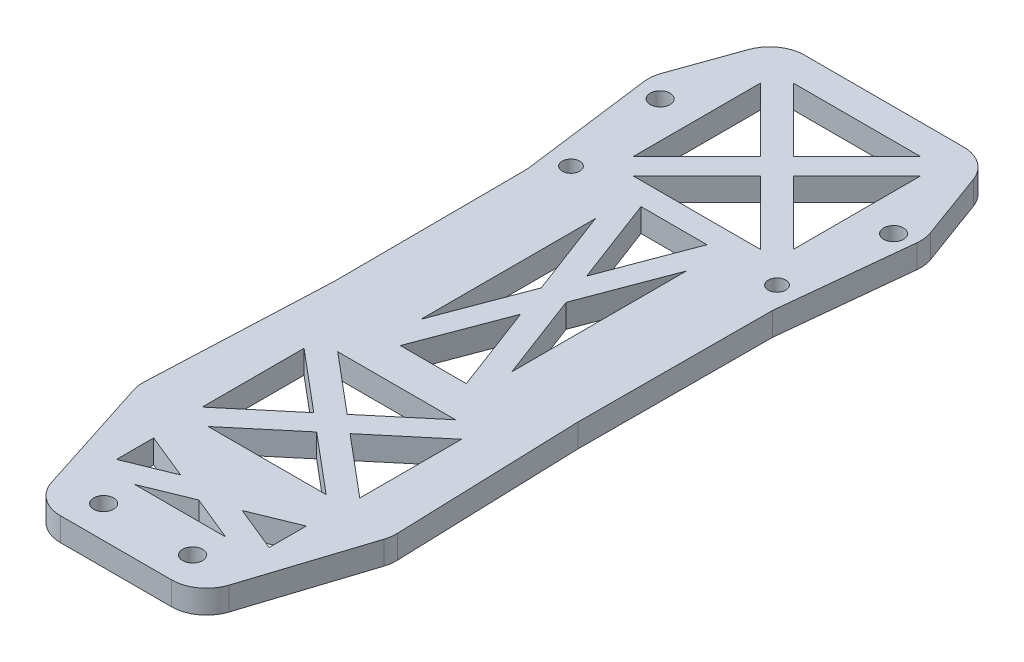
from build123d import *

# Parameters (mm, degrees)
BOSS_EXTRUDE1_DEPTH  = 4
M3_CLEARANCE_HOLE1_D = 3.4
SKETCH4_R            = 1.5
CUT_EXTRUDE1_DEPTH   = 135.330995523


with BuildPart() as part:
    # Sketch1 → Boss-Extrude1 (new body)
    with BuildSketch(Plane(origin=(0, 0, 0), x_dir=(1, 0, 0), z_dir=(0, 1, 0))):
        with BuildLine():
            Line((-9.515488572, 0), (9.515488572, 0))
            ThreePointArc((9.515488572, 0), (13.049333225, 1.15108858), (15.227255138, 4.162686012))
            Line((15.227255138, 4.162686012), (21.674585029, 24.205881435))
            ThreePointArc((21.674585029, 24.205881435), (21.904821248, 25.210967753), (21.959569126, 26.240632696))
            Line((21.959569126, 26.240632696), (20.905492982, 58.256025321))
            Line((20.905492982, 58.256025321), (21.026416806, 91.49070067))
            Line((21.026416806, 91.49070067), (23.354507229, 113.886787435))
            ThreePointArc((23.354507229, 113.886787435), (23.340591043, 115.249277617), (23.019622055, 116.573495146))
            Line((23.019622055, 116.573495146), (18.764127525, 128.174177455))
            ThreePointArc((18.764127525, 128.174177455), (16.566422509, 131.027083341), (13.131169609, 132.107831618))
            Line((13.131169609, 132.107831618), (-14.108422678, 132.107831618))
            ThreePointArc((-14.108422678, 132.107831618), (-17.566572488, 131.011014247), (-19.760402704, 128.121564914))
            Line((-19.760402704, 128.121564914), (-23.659003651, 117.179294294))
            ThreePointArc((-23.659003651, 117.179294294), (-23.973087581, 115.802805743), (-23.956822357, 114.391032075))
            Line((-23.956822357, 114.391032075), (-20.971772171, 91.460387024))
            Line((-20.971772171, 91.460387024), (-20.839350394, 58.395973604))
            Line((-20.839350394, 58.395973604), (-22.202521241, 27.066826186))
            ThreePointArc((-22.202521241, 27.066826186), (-22.154511659, 26.005197672), (-21.919959446, 24.968691386))
            Line((-21.919959446, 24.968691386), (-15.227255138, 4.162686012))
            ThreePointArc((-15.227255138, 4.162686012), (-13.049333225, 1.15108858), (-9.515488572, 0))
        make_face()
        Polygon((-13.5, 28.266780853), (-13.5, 45.722835983), (-3.109490994, 36.994808418), align=None, mode=Mode.SUBTRACT)
        Polygon((-10.104794721, 48.094808418), (0, 39.606780853), (10.104794721, 48.094808418), align=None, mode=Mode.SUBTRACT)
        Polygon((13.5, 28.266780853), (13.5, 45.722835983), (3.109490994, 36.994808418), align=None, mode=Mode.SUBTRACT)
        Polygon((0, 34.382835983), (10.104794721, 25.894808418), (-10.104794721, 25.894808418), align=None, mode=Mode.SUBTRACT)
        Polygon((-13.076324897, 19.530410576), (-13.076324897, 13.159093094), (-5.284733567, 16.344751835), align=None, mode=Mode.SUBTRACT)
        Polygon((5.284733567, 16.344751835), (13.076324897, 19.530410576), (13.076324897, 13.159093094), align=None, mode=Mode.SUBTRACT)
        Polygon((-7.79159133, 10.998384586), (0, 14.184043327), (7.79159133, 10.998384586), align=None, mode=Mode.SUBTRACT)
        Polygon((13.75, 102.323235543), (13.75, 124.166381293), (2.828427125, 113.244808418), align=None, mode=Mode.SUBTRACT)
        Polygon((-10.921572875, 99.494808418), (10.921572875, 99.494808418), (0, 110.416381293), align=None, mode=Mode.SUBTRACT)
        Polygon((-13.75, 102.323235543), (-2.828427125, 113.244808418), (-13.75, 124.166381293), align=None, mode=Mode.SUBTRACT)
        Polygon((0, 116.073235543), (-10.921572875, 126.994808418), (10.921572875, 126.994808418), align=None, mode=Mode.SUBTRACT)
        Polygon((-7.79159133, 89.958123907), (-2.137995178, 74.994808418), (-7.79159133, 60.031492928), align=None, mode=Mode.SUBTRACT)
        Polygon((-5.653596152, 54.372882815), (5.653596152, 54.372882815), (0, 69.336198304), align=None, mode=Mode.SUBTRACT)
        Polygon((-5.653596152, 95.616734021), (5.653596152, 95.616734021), (0, 80.653418531), align=None, mode=Mode.SUBTRACT)
        Polygon((7.79159133, 60.031492928), (7.79159133, 89.958123907), (2.137995178, 74.994808418), align=None, mode=Mode.SUBTRACT)
    extrude(amount=BOSS_EXTRUDE1_DEPTH)

    # M3 Clearance Hole1 (through all)
    with Locations(Plane(origin=(0, 4, 0), x_dir=(1, 0, 0), z_dir=(0, 1, 0))):
        with Locations((-7.62, 5.497333735), (7.62, 5.497333735), (20, 113.244808418), (-20, 113.244808418)):
            Hole(M3_CLEARANCE_HOLE1_D / 2)

    # Sketch4 → Cut-Extrude1 (cut, through all)
    with BuildSketch(Plane(origin=(0, 4, 0), x_dir=(1, 0, 0), z_dir=(0, 1, 0))):
        with Locations(Location((-17.653596152, 95.616734021, 0), (0, 0, 270))):
            Circle(SKETCH4_R)
        with Locations(Location((17.653596152, 95.616734021, 0), (0, 0, 270))):
            Circle(SKETCH4_R)
    extrude(amount=-CUT_EXTRUDE1_DEPTH, mode=Mode.SUBTRACT)


solid = part.part
